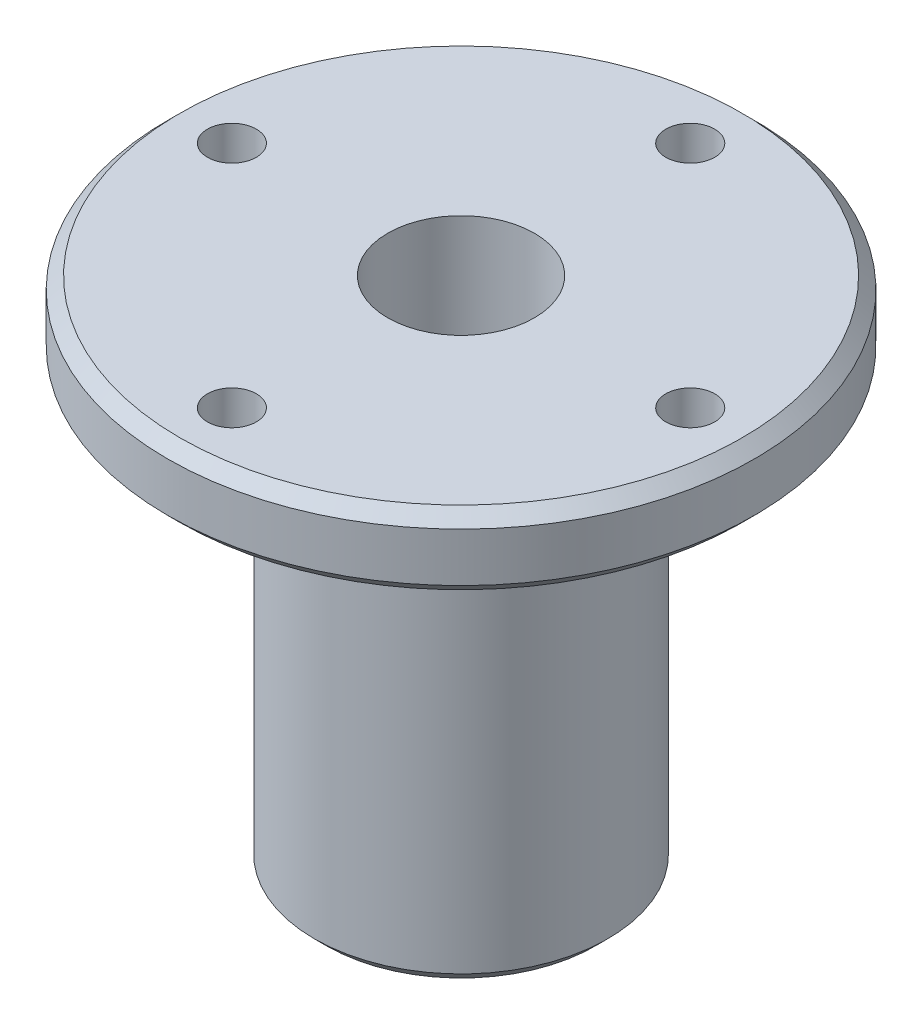
from build123d import *

# Parameters (mm, degrees)
SKETCH1_R                            = 6
SKETCH1_R_2                          = 1.35
EIXO_DEPTH                           = 18
SKETCH2_R                            = 1.5
REBAIXO_DE_ENCAIXE_NO_SERVO_DEPTH    = 4
REBAIXO_START                        = -2
SKETCH3_R                            = 3
REBAIXO_DE_ENCAIXE_DO_PARAFUSO_DEPTH = 15.370705544
SKETCH4_R                            = 12
SKETCH4_R_2                          = 3
SKETCH4_R_3                          = 1
CORPO_DE_FIXA_O_NO_ANTEBRA_O_DEPTH   = 3
RAIO_DE_AL_VIO_0_5MM_R               = 0.5
CHANFROS_0_5MM_SIZE                  = 0.5
ENCAIXE_DA_ENGRENAGEM_DO_SERVO_DEPTH = 4


with BuildPart() as part:
    # Sketch1 → Eixo (new body)
    with BuildSketch(Plane(origin=(0, 0, 0), x_dir=(1, 0, 0), z_dir=(0, 1, 0))):
        with Locations(Location((0, 0, 0), (0, 0, 270))):
            Circle(SKETCH1_R)
        with Locations(Location((0, 0, 0), (0, 0, 270))):
            Circle(SKETCH1_R_2, mode=Mode.SUBTRACT)
    extrude(amount=EIXO_DEPTH)

    # Sketch2 → Rebaixo de Encaixe no Servo (cut)
    with BuildSketch(Plane.XZ):
        with Locations(Location((0, 0, 0), (0, 0, 270))):
            Circle(SKETCH2_R)
    extrude(amount=-REBAIXO_DE_ENCAIXE_NO_SERVO_DEPTH, mode=Mode.SUBTRACT)

    # Sketch3 → Rebaixo de Encaixe do Parafuso (cut, through all)
    with BuildSketch(Plane.XZ.offset(-4).offset(REBAIXO_START)):
        with Locations(Location((0, 0, 0), (0, 0, 270))):
            Circle(SKETCH3_R)
    extrude(amount=-REBAIXO_DE_ENCAIXE_DO_PARAFUSO_DEPTH, mode=Mode.SUBTRACT)

    # Sketch4 → Corpo de Fixação no Antebraço (add)
    with BuildSketch(Plane(origin=(0, 18, 0), x_dir=(1, 0, 0), z_dir=(0, 1, 0))):
        with Locations(Location((0, 0, 0), (0, 0, 270))):
            Circle(SKETCH4_R)
        with Locations(Location((0, 0, 0), (0, 0, 90))):
            Circle(SKETCH4_R_2, mode=Mode.SUBTRACT)
        with Locations(Location((0, 9.375, 0), (0, 0, 270))):
            Circle(SKETCH4_R_3, mode=Mode.SUBTRACT)
        with Locations(Location((9.375, 0, 0), (0, 0, 270))):
            Circle(SKETCH4_R_3, mode=Mode.SUBTRACT)
        with Locations(Location((0, -9.375, 0), (0, 0, 270))):
            Circle(SKETCH4_R_3, mode=Mode.SUBTRACT)
        with Locations(Location((-9.375, 0, 0), (0, 0, 270))):
            Circle(SKETCH4_R_3, mode=Mode.SUBTRACT)
    extrude(amount=CORPO_DE_FIXA_O_NO_ANTEBRA_O_DEPTH)

    # Raio de Alívio - 0.5mm
    raio_de_al_vio_0_5mm_edges = [part.edges().sort_by_distance(p)[0] for p in [
        (0, 18, -6),
    ]]
    fillet(raio_de_al_vio_0_5mm_edges, radius=RAIO_DE_AL_VIO_0_5MM_R)

    # Chanfros 0.5mm
    chanfros_0_5mm_edges = [part.edges().sort_by_distance(p)[0] for p in [
        (0, 0, -6),
        (0, 21, -12),
        (0, 18, -12),
    ]]
    chamfer(chanfros_0_5mm_edges, length=CHANFROS_0_5MM_SIZE)

    # Sketch6 → Encaixe da Engrenagem do Servo (cut)
    with BuildSketch(Plane.XZ):
        with BuildLine():
            Line((-1.674039734, -1.856768959), (-1.692843967, -2.385352029))
            ThreePointArc((-1.692843967, -2.385352029), (-1.670905751, -2.400770495), (-1.648827112, -2.415987201))
            Line((-1.648827112, -2.415987201), (-1.159687035, -2.214751901))
            Line((-1.159687035, -2.214751901), (-1.046447234, -2.731404984))
            ThreePointArc((-1.046447234, -2.731404984), (-1.02136383, -2.740883238), (-0.996194592, -2.750131149))
            Line((-0.996194592, -2.750131149), (-0.572466934, -2.433573835))
            Line((-0.572466934, -2.433573835), (-0.334298372, -2.905833718))
            ThreePointArc((-0.334298372, -2.905833718), (-0.307645864, -2.908776207), (-0.280967502, -2.911474242))
            Line((-0.280967502, -2.911474242), (0.05072337, -2.499485375))
            Line((0.05072337, -2.499485375), (0.398855685, -2.897678233))
            ThreePointArc((0.398855685, -2.897678233), (0.425402623, -2.893900069), (0.45191381, -2.889878701))
            Line((0.45191381, -2.889878701), (0.670726538, -2.408345057))
            Line((0.670726538, -2.408345057), (1.106948173, -2.707450968))
            ThreePointArc((1.106948173, -2.707450968), (1.131721499, -2.697189546), (1.156399715, -2.686701453))
            Line((1.156399715, -2.686701453), (1.248585491, -2.165879561))
            Line((1.248585491, -2.165879561), (1.745487037, -2.3471046))
            ThreePointArc((1.745487037, -2.3471046), (1.766930151, -2.331004685), (1.788224772, -2.314708872))
            Line((1.788224772, -2.314708872), (1.747991225, -1.787323887))
            Line((1.747991225, -1.787323887), (2.27435053, -1.839281019))
            ThreePointArc((2.27435053, -1.839281019), (2.291116083, -1.818354227), (2.307689091, -1.79727462))
            Line((2.307689091, -1.79727462), (2.137564242, -1.29646408))
            Line((2.137564242, -1.29646408), (2.660308215, -1.215888647))
            ThreePointArc((2.660308215, -1.215888647), (2.671342766, -1.191449885), (2.682152817, -1.166910993))
            Line((2.682152817, -1.166910993), (2.392826237, -0.724142666))
            Line((2.392826237, -0.724142666), (2.879108951, -0.51609752))
            ThreePointArc((2.879108951, -0.51609752), (2.883719158, -0.489682365), (2.888087017, -0.463226057))
            Line((2.888087017, -0.463226057), (2.497738158, -0.106320706))
            Line((2.497738158, -0.106320706), (2.917004683, 0.216121913))
            ThreePointArc((2.917004683, 0.216121913), (2.91490087, 0.242853699), (2.912552089, 0.269565076))
            Line((2.912552089, 0.269565076), (2.445708005, 0.518181775))
            Line((2.445708005, 0.518181775), (2.771614282, 0.934761611))
            ThreePointArc((2.771614282, 0.934761611), (2.76292864, 0.960130372), (2.754010801, 0.985418444))
            Line((2.754010801, 0.985418444), (2.240005024, 1.11012499))
            Line((2.240005024, 1.11012499), (2.452073163, 1.594666799))
            ThreePointArc((2.452073163, 1.594666799), (2.437351442, 1.617078523), (2.422424885, 1.639354347))
            Line((2.422424885, 1.639354347), (1.893554289, 1.632314968))
            Line((1.893554289, 1.632314968), (1.97845927, 2.154373208))
            ThreePointArc((1.97845927, 2.154373208), (1.958626489, 2.172419682), (1.938629106, 2.190283587))
            Line((1.938629106, 2.190283587), (1.428124573, 2.051940594))
            Line((1.428124573, 2.051940594), (1.380531504, 2.578712424))
            ThreePointArc((1.380531504, 2.578712424), (1.356833831, 2.591259724), (1.333022129, 2.603589254))
            Line((1.333022129, 2.603589254), (0.872960539, 2.342635246))
            Line((0.872960539, 2.342635246), (0.695859866, 2.841021655))
            ThreePointArc((0.695859866, 2.841021655), (0.669786312, 2.847281387), (0.64365647, 2.853301833))
            Line((0.64365647, 2.853301833), (0.262945183, 2.48613351))
            Line((0.262945183, 2.48613351), (-0.032535206, 2.924819047))
            ThreePointArc((-0.032535206, 2.924819047), (-0.059346343, 2.924397889), (-0.086152492, 2.923730964))
            Line((-0.086152492, 2.923730964), (-0.363591985, 2.473418862))
            Line((-0.363591985, 2.473418862), (-0.758885972, 2.824839302))
            ThreePointArc((-0.758885972, 2.824839302), (-0.784750049, 2.817763716), (-0.810548177, 2.810451326))
            Line((-0.810548177, 2.810451326), (-0.967283332, 2.305290211))
            Line((-0.967283332, 2.305290211), (-1.437553141, 2.547364514))
            ThreePointArc((-1.437553141, 2.547364514), (-1.460845024, 2.534079086), (-1.484014138, 2.520580694))
            Line((-1.484014138, 2.520580694), (-1.51019671, 1.992311697))
            Line((-1.51019671, 1.992311697), (-2.025893559, 2.109829445))
            ThreePointArc((-2.025893559, 2.109829445), (-2.045149734, 2.091168948), (-2.064234034, 2.072332708))
            Line((-2.064234034, 2.072332708), (-1.958218874, 1.554148912))
            Line((-1.958218874, 1.554148912), (-2.486939634, 1.539726033))
            ThreePointArc((-2.486939634, 1.539726033), (-2.500950163, 1.516862973), (-2.514750513, 1.493872437))
            Line((-2.514750513, 1.493872437), (-2.283198945, 1.018333235))
            Line((-2.283198945, 1.018333235), (-2.791722146, 0.872875971))
            ThreePointArc((-2.791722146, 0.872875971), (-2.799606697, 0.84724692), (-2.807255969, 0.821546666))
            Line((-2.807255969, 0.821546666), (-2.464717229, 0.418531936))
            Line((-2.464717229, 0.418531936), (-2.921090488, 0.151179902))
            ThreePointArc((-2.921090488, 0.151179902), (-2.922353645, 0.124395226), (-2.923371208, 0.097600096))
            Line((-2.923371208, 0.097600096), (-2.491368265, -0.207567264))
            Line((-2.491368265, -0.207567264), (-2.866915971, -0.580015356))
            ThreePointArc((-2.866915971, -0.580015356), (-2.861478366, -0.606272677), (-2.855800283, -0.632479046))
            Line((-2.855800283, -0.632479046), (-2.36147747, -0.82062425))
            Line((-2.36147747, -0.82062425), (-2.632602581, -1.274766117))
            ThreePointArc((-2.632602581, -1.274766117), (-2.620805878, -1.298846238), (-2.608788923, -1.322817204))
            Line((-2.608788923, -1.322817204), (-2.083206361, -1.382118395))
            Line((-2.083206361, -1.382118395), (-2.232873088, -1.889418634))
            ThreePointArc((-2.232873088, -1.889418634), (-2.215458518, -1.909808513), (-2.19785776, -1.930037892))
            Line((-2.19785776, -1.930037892), (-1.674039734, -1.856768959))
        make_face()
    extrude(amount=-ENCAIXE_DA_ENGRENAGEM_DO_SERVO_DEPTH, mode=Mode.SUBTRACT)


solid = part.part
